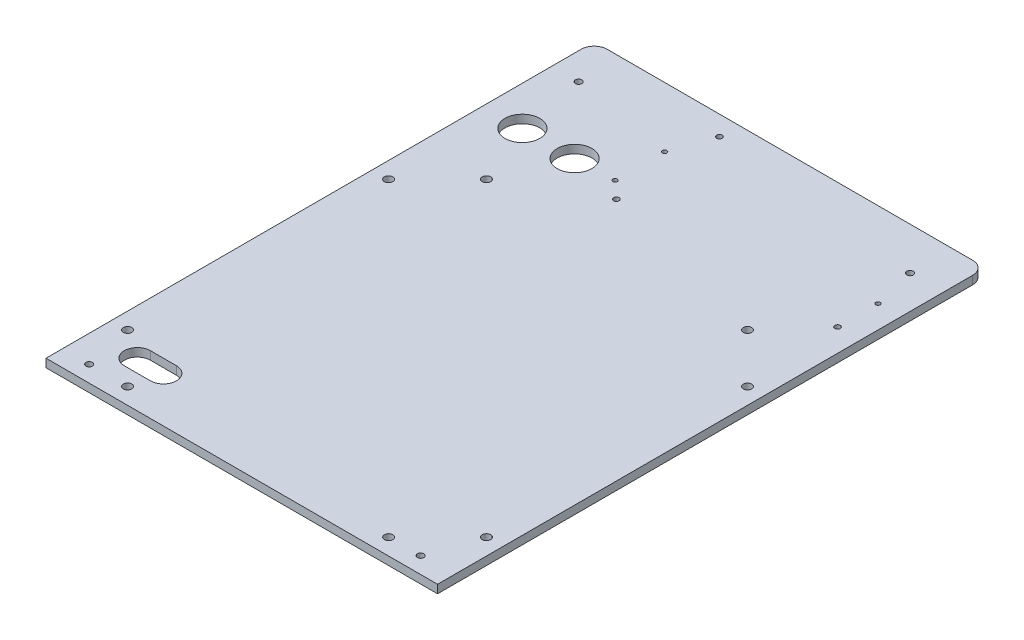
from build123d import *

# Parameters (mm, degrees)
SKETCH1_W           = 300
SKETCH1_H           = 420
BOSS_EXTRUDE1_DEPTH = 6.35
SKETCH3_R           = 3.25
CUT_EXTRUDE1_DEPTH  = 517.178576173
SKETCH4_R           = 2.5
CUT_EXTRUDE2_DEPTH  = 517.178576173
SKETCH6_R           = 1.7
CUT_EXTRUDE3_DEPTH  = 517.178576173
CUT_EXTRUDE4_DEPTH  = 10
SKETCH8_R           = 13.335
CUT_EXTRUDE5_DEPTH  = 517.178576173
SKETCH9_R           = 2.1
CUT_EXTRUDE6_DEPTH  = 517.178576173
CUT_EXTRUDE7_DEPTH  = 517.178576173


with BuildPart() as part:
    # Sketch1 → Boss-Extrude1 (new body)
    with BuildSketch(Plane(origin=(0, 0, 0), x_dir=(1, 0, 0), z_dir=(0, 1, 0))):
        with Locations((150, 210)):
            Rectangle(SKETCH1_W, SKETCH1_H)
    extrude(amount=BOSS_EXTRUDE1_DEPTH)

    # Sketch3 → Cut-Extrude1 (cut, through all)
    with BuildSketch(Plane(origin=(0, 6.35, 0), x_dir=(1, 0, 0), z_dir=(0, 1, 0))):
        with Locations(Location((50, 12.5, 0), (0, 0, 270))):
            Circle(SKETCH3_R)
        with Locations(Location((250, 12.5, 0), (0, 0, 270))):
            Circle(SKETCH3_R)
        with Locations(Location((12.5, 50, 0), (0, 0, 270))):
            Circle(SKETCH3_R)
        with Locations(Location((12.5, 250, 0), (0, 0, 270))):
            Circle(SKETCH3_R)
        with Locations(Location((250, 287.5, 0), (0, 0, 90))):
            Circle(SKETCH3_R)
        with Locations(Location((50, 287.5, 0), (0, 0, 90))):
            Circle(SKETCH3_R)
        with Locations(Location((287.5, 250, 0), (0, 0, 90))):
            Circle(SKETCH3_R)
        with Locations(Location((287.5, 50, 0), (0, 0, 90))):
            Circle(SKETCH3_R)
    extrude(amount=-CUT_EXTRUDE1_DEPTH, mode=Mode.SUBTRACT)

    # Sketch4 → Cut-Extrude2 (cut, through all)
    with BuildSketch(Plane(origin=(0, 6.35, 0), x_dir=(1, 0, 0), z_dir=(0, 1, 0))):
        with Locations(Location((20.55, 12.5, 0), (0, 0, 270))):
            Circle(SKETCH4_R)
        with Locations(Location((274.55, 12.5, 0), (0, 0, 270))):
            Circle(SKETCH4_R)
        with Locations(Location((20.55, 387.5, 0), (0, 0, 270))):
            Circle(SKETCH4_R)
        with Locations(Location((274.55, 387.5, 0), (0, 0, 270))):
            Circle(SKETCH4_R)
    extrude(amount=-CUT_EXTRUDE2_DEPTH, mode=Mode.SUBTRACT)

    # Sketch6 → Cut-Extrude3 (cut, through all)
    with BuildSketch(Plane(origin=(0, 6.35, 0), x_dir=(1, 0, 0), z_dir=(0, 1, 0))):
        with Locations(Location((282.5, 355, 0), (0, 0, 270))):
            Circle(SKETCH6_R)
        with Locations(Location((100, 336, 0), (0, 0, 270))):
            Circle(SKETCH6_R)
        with Locations(Location((100, 374, 0), (0, 0, 270))):
            Circle(SKETCH6_R)
    extrude(amount=-CUT_EXTRUDE3_DEPTH, mode=Mode.SUBTRACT)

    # Sketch7 → Cut-Extrude4 (cut)
    with BuildSketch(Plane(origin=(0, 6.35, 0), x_dir=(1, 0, 0), z_dir=(0, 1, 0))):
        with BuildLine():
            Line((290, 420), (300, 420))
            Line((300, 420), (300, 410))
            ThreePointArc((300, 410), (297.071067812, 417.071067812), (290, 420))
        make_face()
        with BuildLine():
            Line((10, 420), (0, 420))
            Line((0, 420), (0, 410))
            ThreePointArc((0, 410), (2.928932188, 417.071067812), (10, 420))
        make_face()
    extrude(amount=-CUT_EXTRUDE4_DEPTH, mode=Mode.SUBTRACT)

    # Sketch8 → Cut-Extrude5 (cut, through all)
    with BuildSketch(Plane(origin=(0, 6.35, 0), x_dir=(1, 0, 0), z_dir=(0, 1, 0))):
        with Locations(Location((70, 335, 0), (0, 0, 270))):
            Circle(SKETCH8_R)
        with Locations(Location((30, 335, 0), (0, 0, 270))):
            Circle(SKETCH8_R)
    extrude(amount=-CUT_EXTRUDE5_DEPTH, mode=Mode.SUBTRACT)

    # Sketch9 → Cut-Extrude6 (cut, through all)
    with BuildSketch(Plane(origin=(0, 6.35, 0), x_dir=(1, 0, 0), z_dir=(0, 1, 0))):
        with Locations(Location((282.5, 324, 0), (0, 0, 270))):
            Circle(SKETCH9_R)
        with Locations(Location((111, 405, 0), (0, 0, 270))):
            Circle(SKETCH9_R)
        with Locations(Location((113, 324, 0), (0, 0, 270))):
            Circle(SKETCH9_R)
    extrude(amount=-CUT_EXTRUDE6_DEPTH, mode=Mode.SUBTRACT)

    # Sketch10 → Cut-Extrude7 (cut, through all)
    with BuildSketch(Plane(origin=(0, 6.35, 0), x_dir=(1, 0, 0), z_dir=(0, 1, 0))):
        with BuildLine():
            Line((55, 25), (35, 25))
            ThreePointArc((35, 25), (25, 35), (35, 45))
            Line((35, 45), (55, 45))
            ThreePointArc((55, 45), (65, 35), (55, 25))
        make_face()
    extrude(amount=-CUT_EXTRUDE7_DEPTH, mode=Mode.SUBTRACT)


solid = part.part
